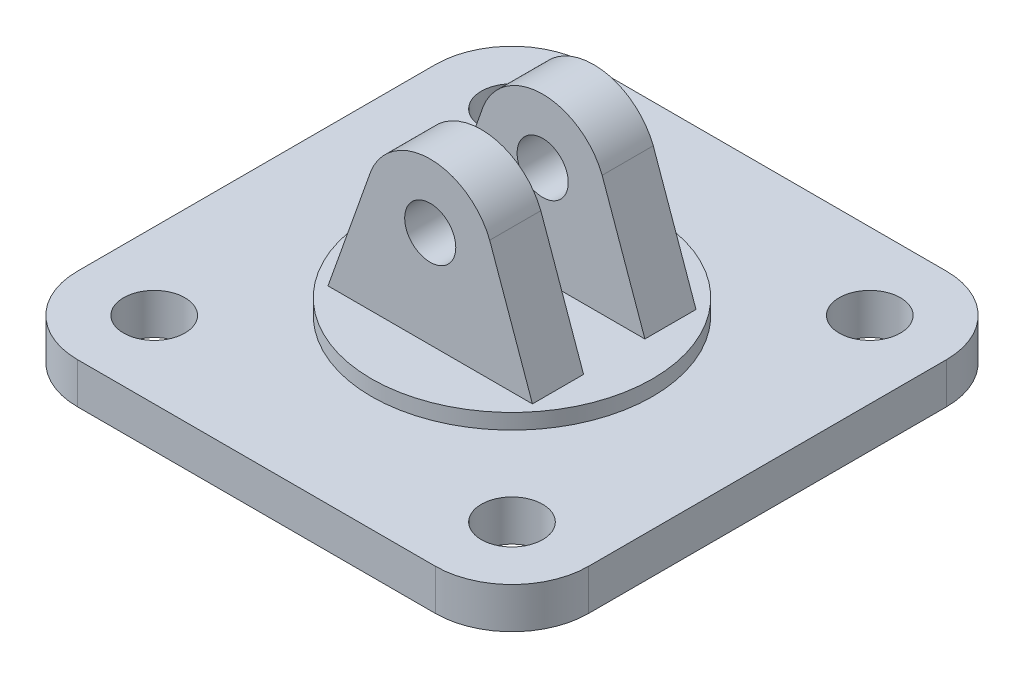
from build123d import *

# Parameters (mm, degrees)
EXTRUDE_3_DEPTH             = 8
SKETCH_4_R                  = 27.5
EXTRUDE_4_DEPTH             = 3
SKETCH_6_R                  = 6
CUT_EXTRUDE_1_DEPTH         = 72.161787499
PATTERN_LINEAR_1_COUNT      = 2
PATTERN_LINEAR_1_PITCH      = 70
PATTERN_LINEAR_1_COUNT_DIR2 = 2
PATTERN_LINEAR_1_PITCH_DIR2 = 70
CUT_EXTRUDE_2_DEPTH         = 2
SKETCH_13_R                 = 5
EXTRUDE_6_DEPTH             = 16
SKETCH_14_W                 = 40
SKETCH_14_H                 = 35
CUT_EXTRUDE_3_DEPTH         = 6


with BuildPart() as part:
    # 草圖3 → 填料-伸長3 (new body)
    with BuildSketch(Plane(origin=(0, 0, 0), x_dir=(1, 0, 0), z_dir=(0, 1, 0))):
        with BuildLine():
            Line((35, 50), (-35, 50))
            ThreePointArc((-35, 50), (-45.606601718, 45.606601718), (-50, 35))
            Line((-50, 35), (-50, -35))
            ThreePointArc((-50, -35), (-45.606601718, -45.606601718), (-35, -50))
            Line((-35, -50), (35, -50))
            ThreePointArc((35, -50), (45.606601718, -45.606601718), (50, -35))
            Line((50, -35), (50, 35))
            ThreePointArc((50, 35), (45.606601718, 45.606601718), (35, 50))
        make_face()
    extrude(amount=EXTRUDE_3_DEPTH)

    # 草圖4 → 填料-伸長4 (add)
    with BuildSketch(Plane(origin=(0, 8, 0), x_dir=(1, 0, 0), z_dir=(0, 1, 0))):
        with Locations(Location((0, 0, 0), (0, 0, 270))):
            Circle(SKETCH_4_R)
    extrude(amount=EXTRUDE_4_DEPTH)

    # 草圖6 → 除料-伸長1 (cut, through all)
    with BuildSketch(Plane(origin=(0, 8, 0), x_dir=(1, 0, 0), z_dir=(0, 1, 0))):
        with Locations(Location((-35, 35, 0), (0, 0, 270))):
            Circle(SKETCH_6_R)
    cut_extrude_1 = extrude(amount=-CUT_EXTRUDE_1_DEPTH, mode=Mode.SUBTRACT)

    # 直線複製排列1: Cut-Extrude 1 2 × 2
    with Locations(*[(i * PATTERN_LINEAR_1_PITCH, 0, j * PATTERN_LINEAR_1_PITCH_DIR2) for i in range(PATTERN_LINEAR_1_COUNT) for j in range(PATTERN_LINEAR_1_COUNT_DIR2) if (i, j) != (0, 0)]):
        add(cut_extrude_1, mode=Mode.SUBTRACT)

    # 草圖9 → 除料-伸長2 (cut)
    with BuildSketch(Plane.XZ):
        with BuildLine():
            Line((-20, -25), (20, -25))
            ThreePointArc((20, -25), (23.535533906, -23.535533906), (25, -20))
            Line((25, -20), (25, 20))
            ThreePointArc((25, 20), (23.535533906, 23.535533906), (20, 25))
            Line((20, 25), (-20, 25))
            ThreePointArc((-20, 25), (-23.535533906, 23.535533906), (-25, 20))
            Line((-25, 20), (-25, -20))
            ThreePointArc((-25, -20), (-23.535533906, -23.535533906), (-20, -25))
        make_face()
    extrude(amount=-CUT_EXTRUDE_2_DEPTH, mode=Mode.SUBTRACT)

    # 草圖13 → 填料-伸長6 (add, symmetric)
    with BuildSketch(Plane.XY):
        with BuildLine():
            Line((-20, 11), (20, 11))
            Line((20, 11), (11.638479247, 34.560241312))
            ThreePointArc((11.638479247, 34.560241312), (0, 42.5), (-11.638479247, 34.560241312))
            Line((-11.638479247, 34.560241312), (-20, 11))
        make_face()
        with Locations((0, 30)):
            Circle(SKETCH_13_R, mode=Mode.SUBTRACT)
    extrude(amount=EXTRUDE_6_DEPTH, both=True)

    # 草圖14 → 除料-伸長3 (cut, symmetric)
    with BuildSketch(Plane.XY):
        with Locations((0, 28.5)):
            Rectangle(SKETCH_14_W, SKETCH_14_H)
    extrude(amount=CUT_EXTRUDE_3_DEPTH, both=True, mode=Mode.SUBTRACT)


solid = part.part
